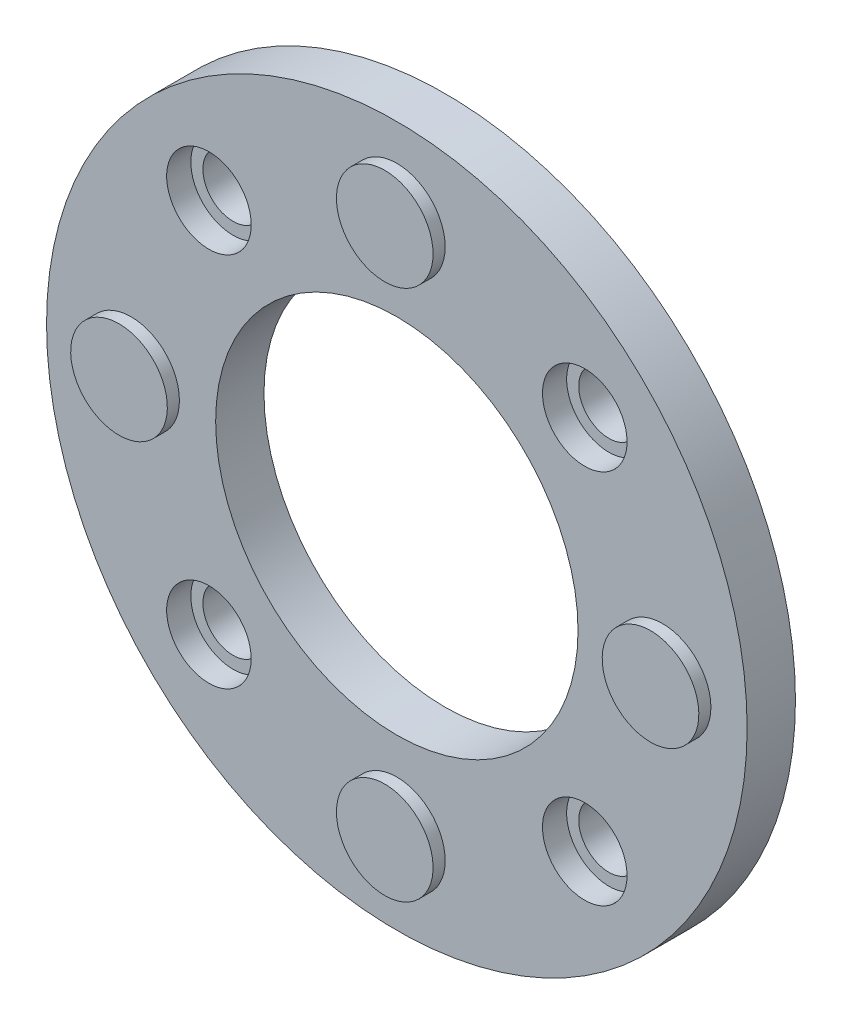
from build123d import *

# Parameters (mm, degrees)
SKETCH_1_R                = 29.000000000000004
SKETCH_1_R_2              = 15.000000000000002
EXTRUDE_1_DEPTH           = 2
SKETCH_2_R                = 4.000000000000001
EXTRUDE_2_DEPTH           = 3
SKETCH_3_R                = 2.5
CUT_EXTRUDE_1_DEPTH       = 4.5
PATTERN_CIRCULAR_1_COUNT  = 4
HOLE_WIZARD_1_D           = 5
HOLE_WIZARD_1_CBORE_D     = 7
HOLE_WIZARD_1_CBORE_DEPTH = 2
SKETCH_6_R                = 3.5000000000000013
SKETCH_6_R_2              = 2.500000000000015
EXTRUDE_3_DEPTH           = 1
PATTERN_CIRCULAR_2_COUNT  = 4


with BuildPart() as part:
    # 草图1 → 凸台-拉伸1 (new, symmetric)
    with BuildSketch(Plane.XY):
        Circle(SKETCH_1_R)
        Circle(SKETCH_1_R_2, mode=Mode.SUBTRACT)
    extrude(amount=EXTRUDE_1_DEPTH, both=True)

    # 草图2 → 凸台-拉伸2 (add, symmetric)
    with BuildSketch(Plane.XY):
        with Locations((0, 22)):
            Circle(SKETCH_2_R)
    extrude_2 = extrude(amount=EXTRUDE_2_DEPTH, both=True)

    # 草图3 → 切除-拉伸1 (cut)
    with BuildSketch(Plane(origin=(0, 0, -3), x_dir=(-1, 0, 0), z_dir=(0, 0, -1))):
        with Locations((0, 22)):
            Circle(SKETCH_3_R)
    cut_extrude_1 = extrude(amount=-CUT_EXTRUDE_1_DEPTH, mode=Mode.SUBTRACT)

    # 阵列(圆周)1: 凸台-拉伸2, 切除-拉伸1 ×4 about axis
    pattern_circular_1_axis = Axis((-3.841e-14, 0, 0), (0, 0, 1))
    add([extrude_2.rotate(pattern_circular_1_axis, i * 360 / PATTERN_CIRCULAR_1_COUNT) for i in range(1, PATTERN_CIRCULAR_1_COUNT)])
    add([cut_extrude_1.rotate(pattern_circular_1_axis, i * 360 / PATTERN_CIRCULAR_1_COUNT) for i in range(1, PATTERN_CIRCULAR_1_COUNT)], mode=Mode.SUBTRACT)

    # 孔1 (through all)
    with Locations(Plane.XY.offset(2)):
        with Locations((-15.556349186, 15.556349186)):
            hole_wizard_1 = CounterBoreHole(HOLE_WIZARD_1_D / 2, HOLE_WIZARD_1_CBORE_D / 2, HOLE_WIZARD_1_CBORE_DEPTH)

    # 草图6 → 凸台-拉伸3 (add)
    with BuildSketch(Plane(origin=(0, 0, -2), x_dir=(-1, 0, 0), z_dir=(0, 0, -1))):
        with Locations(Location((15.556349186104072, 15.556349186104015, 0), (0, 0, 180))):
            Circle(SKETCH_6_R)
        with Locations(Location((15.556349186104072, 15.556349186104015, 0), (0, 0, 180))):
            Circle(SKETCH_6_R_2, mode=Mode.SUBTRACT)
    extrude_3 = extrude(amount=EXTRUDE_3_DEPTH)

    # 阵列(圆周)2: 孔1, 凸台-拉伸3 ×4 about axis
    pattern_circular_2_axis = Axis((2.732e-14, 2.732e-14, 0), (0, 0, 1))
    add([hole_wizard_1.rotate(pattern_circular_2_axis, i * 360 / PATTERN_CIRCULAR_2_COUNT) for i in range(1, PATTERN_CIRCULAR_2_COUNT)], mode=Mode.SUBTRACT)
    add([extrude_3.rotate(pattern_circular_2_axis, i * 360 / PATTERN_CIRCULAR_2_COUNT) for i in range(1, PATTERN_CIRCULAR_2_COUNT)])


solid = part.part
